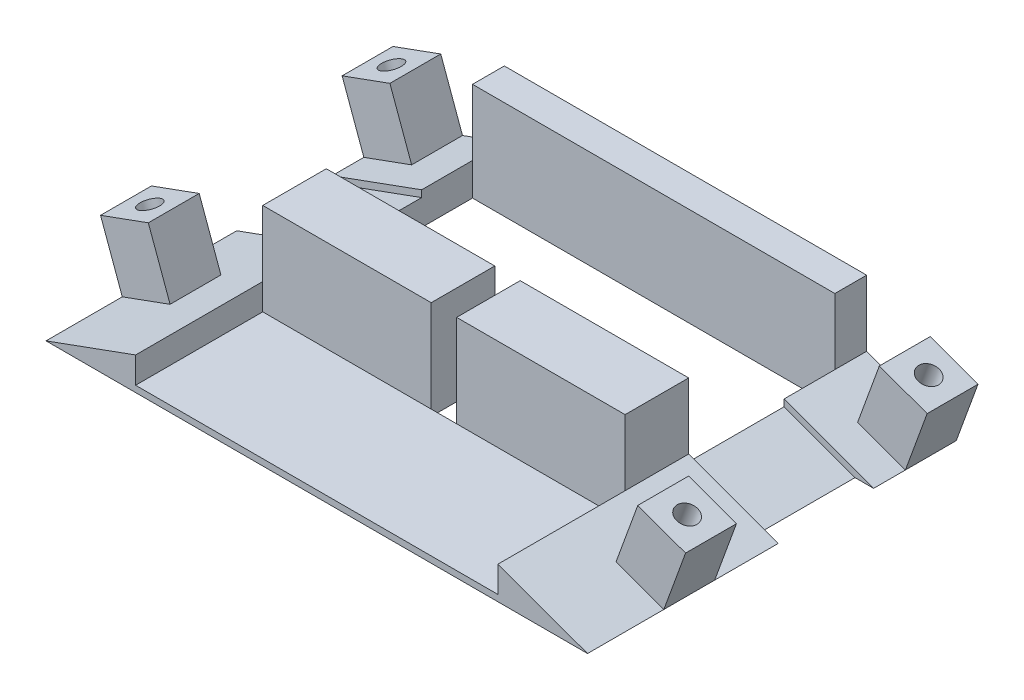
from build123d import *

# Parameters (mm, degrees)
BOSS_EXTRUDE1_DEPTH        = 30
BOSS_EXTRUDE1_DEPTH_BACK   = 28
BOSS_EXTRUDE1_2_DEPTH      = 30
BOSS_EXTRUDE1_2_DEPTH_BACK = 28
SKETCH3_W                  = 57
SKETCH3_H                  = 15.5
BOSS_EXTRUDE2_DEPTH        = 10
SKETCH4_W                  = 57
SKETCH4_H                  = 15.5
BOSS_EXTRUDE3_DEPTH        = 5
SKETCH8_W                  = 8
SKETCH8_H                  = 8
BOSS_EXTRUDE7_DEPTH        = 10
SKETCH9_R                  = 1.65
CUT_EXTRUDE1_DEPTH         = 10
SKETCH10_W                 = 8
SKETCH10_H                 = 8
BOSS_EXTRUDE8_DEPTH        = 10
SKETCH11_R                 = 1.65
CUT_EXTRUDE2_DEPTH         = 10
SKETCH12_W                 = 57
SKETCH12_H                 = 20
BOSS_EXTRUDE9_DEPTH        = 1
LPATTERN5_COUNT            = 2
LPATTERN5_PITCH            = 38
LPATTERN6_COUNT            = 2
LPATTERN6_PITCH            = 38
SKETCH13_W                 = 4
SKETCH13_H                 = 10
CUT_EXTRUDE3_DEPTH         = 15.5
SKETCH15_W                 = 15
SKETCH15_H                 = 15
CUT_EXTRUDE4_DEPTH         = 1


with BuildPart() as part:
    # Sketch2 → Boss-Extrude1 (new, two sides: drawn at the far end of the back side and taken through both)
    with BuildSketch(Plane.XY.offset(-BOSS_EXTRUDE1_DEPTH_BACK)):
        Polygon((-14.095389312, 0), (0, 5.13030215), (0, 0), align=None)
    extrude(amount=BOSS_EXTRUDE1_DEPTH + BOSS_EXTRUDE1_DEPTH_BACK)



with BuildPart() as body_2:
    # Sketch2 → Boss-Extrude1 2 (new, two sides: drawn at the far end of the back side and taken through both)
    with BuildSketch(Plane.XY.offset(-BOSS_EXTRUDE1_2_DEPTH_BACK)):
        Polygon((71.095389312, 0), (57, 5.13030215), (57, 0), align=None)
    extrude(amount=BOSS_EXTRUDE1_2_DEPTH + BOSS_EXTRUDE1_2_DEPTH_BACK)


with BuildPart() as part_1:
    add(part.part)

    add(body_2.part)  # Boss-Extrude2 merges body 2
    # Sketch3 → Boss-Extrude2 (add)
    with BuildSketch(Plane.XY):
        with Locations((28.5, 7.75)):
            Rectangle(SKETCH3_W, SKETCH3_H)
    extrude(amount=BOSS_EXTRUDE2_DEPTH)

    # Sketch12 → Boss-Extrude9 (add)
    with BuildSketch(Plane(origin=(0, 0, 0), x_dir=(1, 0, 0), z_dir=(0, 1, 0))):
        with Locations((28.5, -20)):
            Rectangle(SKETCH12_W, SKETCH12_H)
    extrude(amount=BOSS_EXTRUDE9_DEPTH)


with BuildPart() as body_2_2:
    # Sketch4 → Boss-Extrude3 (new body)
    with BuildSketch(Plane.XY.offset(-23)):
        with Locations((28.5, 7.75)):
            Rectangle(SKETCH4_W, SKETCH4_H)
    extrude(amount=-BOSS_EXTRUDE3_DEPTH)


with BuildPart() as body_3:
    # Sketch8 → Boss-Extrude7 (new body)
    with BuildSketch(Plane(origin=(-1.648847328, 4.530170802, 0), x_dir=(0.9396926207859082, 0.3420201433256695, 0), z_dir=(-0.3420201433256695, 0.9396926207859082, 0))):
        with Locations((-9.245333323, 24)):
            Rectangle(SKETCH8_W, SKETCH8_H)
    boss_extrude7 = extrude(amount=BOSS_EXTRUDE7_DEPTH)

    # Sketch9 → Cut-Extrude1 (cut)
    with BuildSketch(Plane(origin=(-5.069048761, 13.92709701, 0), x_dir=(0.9396926207859082, 0.34202014332566943, 0), z_dir=(-0.34202014332566943, 0.9396926207859082, 0))):
        with Locations(Location((-9.245333323, 24, 0), (0, 0, 180))):
            Circle(SKETCH9_R)
    cut_extrude1 = extrude(amount=-CUT_EXTRUDE1_DEPTH, mode=Mode.SUBTRACT)


with BuildPart() as body_4:
    # Sketch10 → Boss-Extrude8 (new body)
    with BuildSketch(Plane(origin=(8.316580699, 22.849617678, 0), x_dir=(0.9396926207859082, -0.34202014332566943, 0), z_dir=(0.34202014332566943, 0.9396926207859083, 0))):
        with Locations((62.807812708, 24)):
            Rectangle(SKETCH10_W, SKETCH10_H)
    boss_extrude8 = extrude(amount=BOSS_EXTRUDE8_DEPTH)

    # Sketch11 → Cut-Extrude2 (cut)
    with BuildSketch(Plane(origin=(11.736782132, 32.246543886, 0), x_dir=(0.9396926207859083, -0.342020143325669, 0), z_dir=(0.342020143325669, 0.9396926207859083, 0))):
        with Locations(Location((62.807812708, 24, 0), (0, 0, 180))):
            Circle(SKETCH11_R)
    cut_extrude2 = extrude(amount=-CUT_EXTRUDE2_DEPTH, mode=Mode.SUBTRACT)


with BuildPart() as part_2:
    add(part_1.part)

    # LPattern5: Boss-Extrude7, Cut-Extrude1 ×2
    with Locations(*[(0, 0, i * LPATTERN5_PITCH) for i in range(1, LPATTERN5_COUNT)]):
        add(boss_extrude7)
        add(cut_extrude1, mode=Mode.SUBTRACT)

    # LPattern6: Boss-Extrude8, Cut-Extrude2 ×2
    with Locations(*[(0, 0, i * LPATTERN6_PITCH) for i in range(1, LPATTERN6_COUNT)]):
        add(boss_extrude8)
        add(cut_extrude2, mode=Mode.SUBTRACT)

    # Sketch13 → Cut-Extrude3 (cut)
    with BuildSketch(Plane(origin=(0, 0, 0), x_dir=(1, 0, 0), z_dir=(0, 1, 0))):
        with Locations((28.5, -5)):
            Rectangle(SKETCH13_W, SKETCH13_H)
    extrude(amount=CUT_EXTRUDE3_DEPTH, mode=Mode.SUBTRACT)

    # Sketch15 → Cut-Extrude4 (cut)
    with BuildSketch(Plane(origin=(-1.648847328, 4.530170802, 0), x_dir=(0.9396926207859082, 0.3420201433256695, 0), z_dir=(-0.3420201433256695, 0.9396926207859082, 0))):
        with Locations((-5.745333323, 7.5)):
            Rectangle(SKETCH15_W, SKETCH15_H)
    cut_extrude4 = extrude(amount=-CUT_EXTRUDE4_DEPTH, mode=Mode.SUBTRACT)

    # Mirror5: Cut-Extrude4 across plane
    add(cut_extrude4.mirror(Plane(origin=(28.5, 0, 0), x_dir=(0, 0, 1), z_dir=(1, 0, 0))), mode=Mode.SUBTRACT)


solid = Compound([body_2_2.part, body_3.part, body_4.part, part_2.part])
